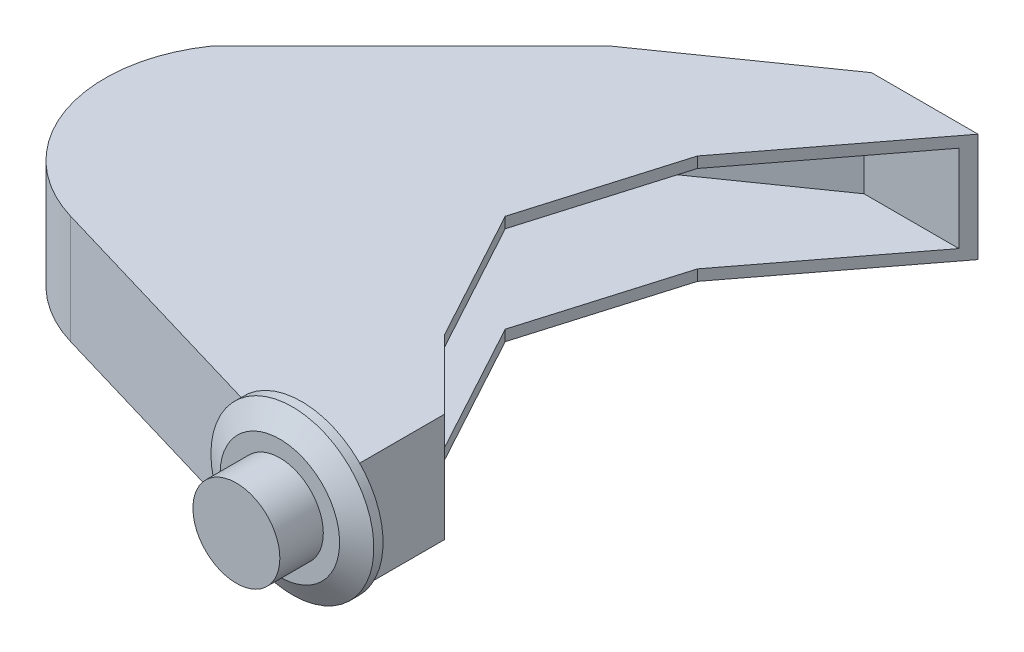
from build123d import *

# Parameters (mm, degrees)
SKETCH1_R           = 4
BOSS_EXTRUDE1_DEPTH = 4
SKETCH2_R           = 7.5
BOSS_EXTRUDE2_DEPTH = 2
CHAMFER1_SIZE       = 2
CHAMFER1_SIZE2      = 1.154700538
BOSS_EXTRUDE3_DEPTH = 5
SHELL3_T            = -1


with BuildPart() as part:
    # Sketch1 → Boss-Extrude1 (new body)
    with BuildSketch(Plane.XY):
        Circle(SKETCH1_R)
    extrude(amount=-BOSS_EXTRUDE1_DEPTH)

    # Sketch2 → Boss-Extrude2 (add)
    with BuildSketch(Plane(origin=(0, 0, -4), x_dir=(-1, 0, 0), z_dir=(0, 0, -1))):
        Circle(SKETCH2_R)
    extrude(amount=BOSS_EXTRUDE2_DEPTH)

    # Chamfer1
    chamfer1_edges = [part.edges().sort_by_distance(p)[0] for p in [
        (7.5, 0, -4),
    ]]
    chamfer1_side = [part.faces().sort_by_distance(p)[0] for p in [
        (7.287867966, 0, -4),
    ]]
    chamfer(chamfer1_edges, length=CHAMFER1_SIZE, length2=CHAMFER1_SIZE2, reference=chamfer1_side[0])


with BuildPart() as body_2:
    # Sketch3 → Boss-Extrude3 (new, symmetric)
    with BuildSketch(Plane(origin=(0, 0, 0), x_dir=(1, 0, 0), z_dir=(0, 1, 0))):
        with BuildLine():
            Line((5.09320586, 6), (-5.465077698, 6))
            Line((-5.465077698, 6), (-27.928776589, 12.647224621))
            ThreePointArc((-27.928776589, 12.647224621), (-36.559963647, 20.836216547), (-35.004066658, 32.631815869))
            Line((-35.004066658, 32.631815869), (-16.556260421, 51.079622106))
            Line((-16.556260421, 51.079622106), (-2.482557919, 60.932976146))
            Line((-2.482557919, 60.932976146), (7.323545861, 60.932976146))
            Line((7.323545861, 60.932976146), (-3.847964774, 46.285884424))
            Line((-3.847964774, 46.285884424), (-7.888335023, 32.631815869))
            Line((-7.888335023, 32.631815869), (-1.217588096, 20.354009814))
            Line((-1.217588096, 20.354009814), (5.09320586, 14.043215857))
            Line((5.09320586, 14.043215857), (5.09320586, 6))
        make_face()
    extrude(amount=BOSS_EXTRUDE3_DEPTH, both=True)

    # Shell3
    shell3_openings = [body_2.faces().sort_by_distance(p)[0] for p in [
        (1.737790543, 0, -53.609430285),
        (-5.868149899, 0, -39.458850146),
        (-4.55296156, 0, -26.492912841),
        (1.937808882, 0, -17.198612835),
    ]]
    offset(amount=SHELL3_T, openings=shell3_openings, kind=Kind.INTERSECTION)


solid = Compound([part.part, body_2.part])
